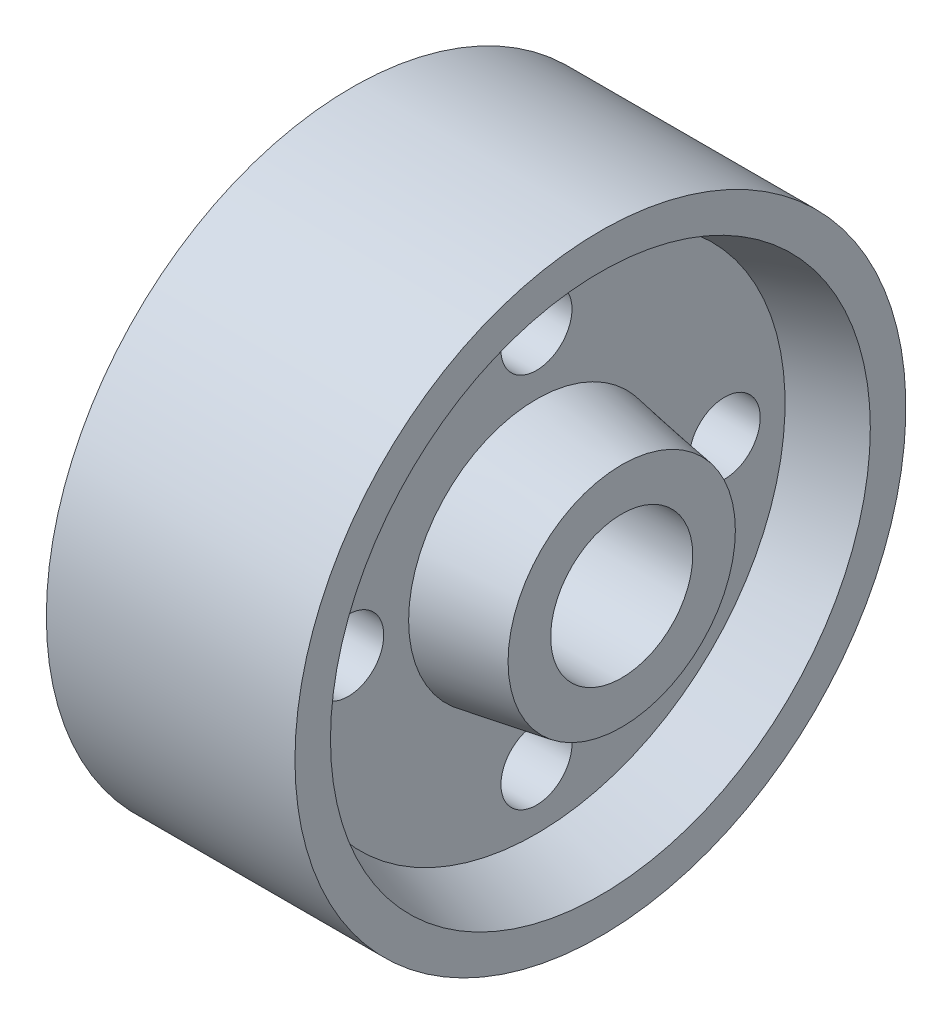
from build123d import *

# Parameters (mm, degrees)
SKETCH2_R          = 5
CUT_EXTRUDE1_DEPTH = 74.341666193
SKETCH3_R          = 10
CUT_EXTRUDE2_DEPTH = 74.341666193


with BuildPart() as part:
    # Sketch1 → Revolve1 (revolve)
    with BuildSketch(Plane(origin=(0, 0, 0), x_dir=(1, 0, 0), z_dir=(0, 1, 0)), mode=Mode.PRIVATE) as revolve1_sk:
        Polygon((0, 0), (0, 16), (12, 18), (12, 35), (3, 38), (3, 43), (38, 43), (38, 38), (29, 35), (29, 18), (41, 16), (41, 0), align=None)
    revolve(revolve1_sk.sketch.rotate(Axis((0, 0, 0), (1, 0, 0)), 180), axis=Axis((0, 0, 0), (1, 0, 0)))

    # Sketch2 → Cut-Extrude1 (cut, through all)
    with BuildSketch(Plane(origin=(41, 0, 0), x_dir=(0, 0, -1), z_dir=(1, 0, 0))):
        with Locations((0, 26.5)):
            Circle(SKETCH2_R)
        with Locations((26.5, 0)):
            Circle(SKETCH2_R)
        with Locations((0, -26.5)):
            Circle(SKETCH2_R)
        with Locations((-26.5, 0)):
            Circle(SKETCH2_R)
    extrude(amount=-CUT_EXTRUDE1_DEPTH, mode=Mode.SUBTRACT)

    # Sketch3 → Cut-Extrude2 (cut, through all)
    with BuildSketch(Plane(origin=(41, 0, 0), x_dir=(0, 0, -1), z_dir=(1, 0, 0))):
        Circle(SKETCH3_R)
    extrude(amount=-CUT_EXTRUDE2_DEPTH, mode=Mode.SUBTRACT)


solid = part.part
